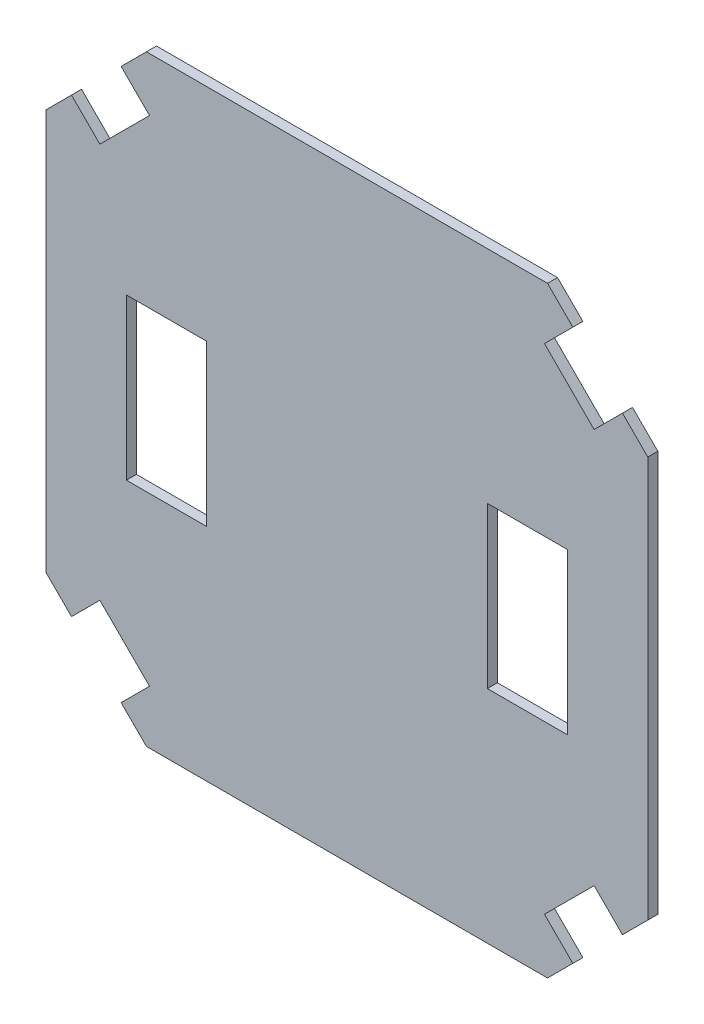
from build123d import *

# Parameters (mm, degrees)
ESQUISSE1_W        = 40
ESQUISSE1_H        = 80
BOSS_EXTRU_1_DEPTH = 5


with BuildPart() as part:
    # Esquisse1 → Boss.-Extru.1 (new body)
    with BuildSketch(Plane.XY):
        Polygon((112.625631329, 137.374368671), (100, 150), (-100, 150), (-112.625631329, 137.374368671), (-98.483495706, 123.232233047), (-123.232233047, 98.483495706), (-137.374368671, 112.625631329), (-150, 100), (-150, -100), (-137.374368671, -112.625631329), (-123.232233047, -98.483495706), (-98.483495706, -123.232233047), (-112.625631329, -137.374368671), (-100, -150), (100, -150), (112.625631329, -137.374368671), (98.483495706, -123.232233047), (123.232233047, -98.483495706), (137.374368671, -112.625631329), (150, -100), (150, 100), (137.374368671, 112.625631329), (123.232233047, 98.483495706), (98.483495706, 123.232233047), align=None)
        with Locations((-90, 0)):
            Rectangle(ESQUISSE1_W, ESQUISSE1_H, mode=Mode.SUBTRACT)
        with Locations((90, 0)):
            Rectangle(ESQUISSE1_W, ESQUISSE1_H, mode=Mode.SUBTRACT)
    extrude(amount=BOSS_EXTRU_1_DEPTH)


solid = part.part
